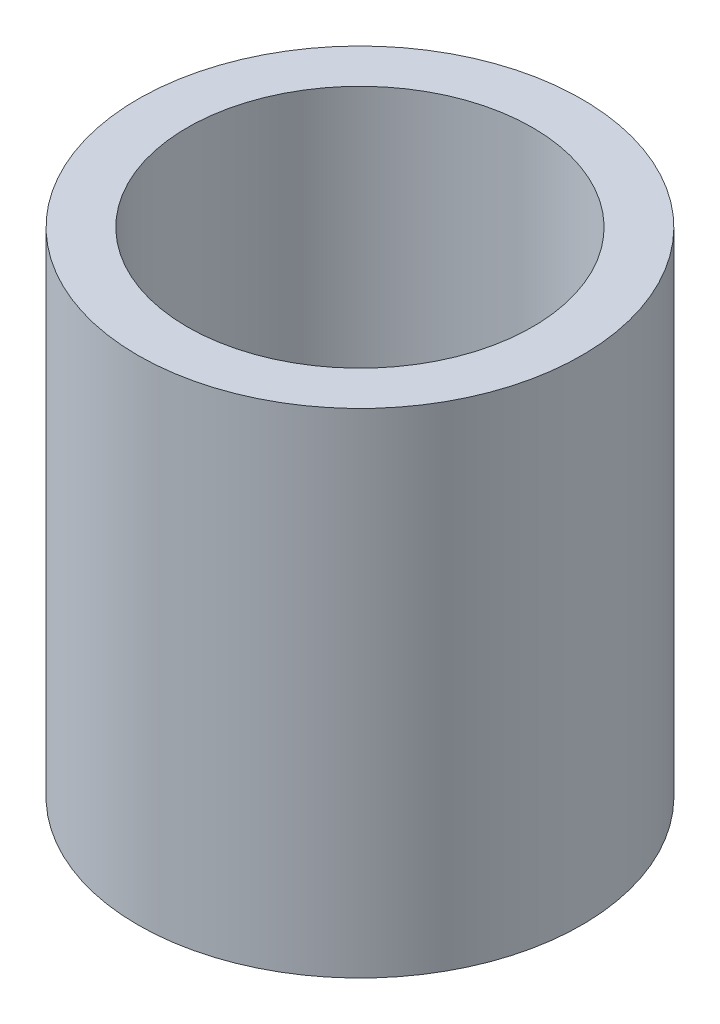
from build123d import *

# Parameters (mm, degrees)
SKETCH1_R           = 4.5
SKETCH1_R_2         = 3.5
BOSS_EXTRUDE1_DEPTH = 10


with BuildPart() as part:
    # Sketch1 → Boss-Extrude1 (new body)
    with BuildSketch(Plane(origin=(0, 0, 0), x_dir=(1, 0, 0), z_dir=(0, 1, 0))):
        with Locations(Location((0, 0, 0), (0, 0, 270))):
            Circle(SKETCH1_R)
        with Locations(Location((0, 0, 0), (0, 0, 270))):
            Circle(SKETCH1_R_2, mode=Mode.SUBTRACT)
    extrude(amount=BOSS_EXTRUDE1_DEPTH)


solid = part.part
